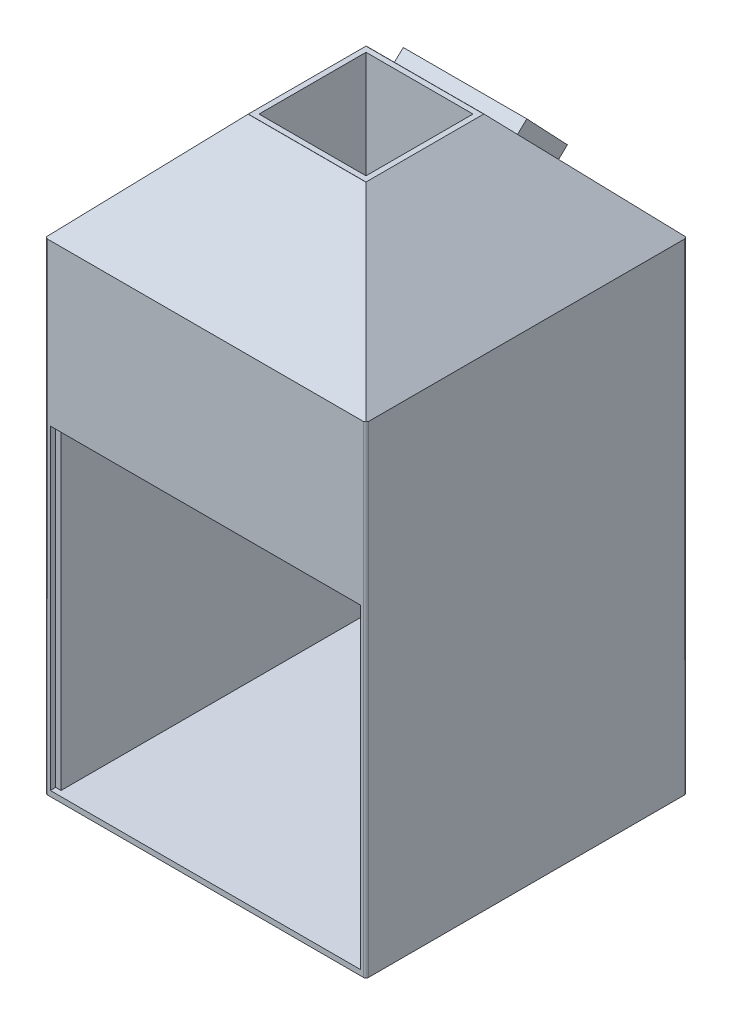
from build123d import *

# Parameters (mm, degrees)
SKETCH1_W            = 600
SKETCH1_H            = 600
BOSS_EXTRUDE1_DEPTH  = 10
SKETCH2_W            = 600
SKETCH2_H            = 600
SKETCH2_W_2          = 560
SKETCH2_H_2          = 560
BOSS_AREA_C_DEPTH    = 590
SKETCH4_W            = 560
SKETCH4_H            = 20
CUT_AREA_C_DEPTH     = 590
SKETCH5_W            = 600
SKETCH5_H            = 600
SKETCH5_W_2          = 560
SKETCH5_H_2          = 560
AREA_B_DEPTH         = 300
SKETCH7_W            = 10
SKETCH7_H            = 590
CUT_EXTRUDE3_DEPTH   = 10
SKETCH8_W            = 220
SKETCH8_H            = 220
SKETCH8_W_2          = 200
SKETCH8_H_2          = 200
BOSS_EXTRUDE7_DEPTH  = 210
BOSS_EXTRUDE8_DEPTH  = 600
CUT_EXTRUDE4_DEPTH   = 600
BOSS_EXTRUDE9_DEPTH  = 600
CUT_EXTRUDE5_DEPTH   = 600
SKETCH16_W           = 231
SKETCH16_H           = 110
SKETCH16_W_2         = 210
SKETCH16_H_2         = 100
BOSS_EXTRUDE13_DEPTH = 25
SKETCH18_R           = 10
CUT_EXTRUDE6_DEPTH   = 35
FILLET1_R            = 5


with BuildPart() as part:
    # Sketch1 → Boss-Extrude1 (new body)
    with BuildSketch(Plane(origin=(0, 0, 0), x_dir=(1, 0, 0), z_dir=(0, 1, 0))):
        Rectangle(SKETCH1_W, SKETCH1_H)
    extrude(amount=BOSS_EXTRUDE1_DEPTH)

    # Sketch2 → Boss-Area C (add)
    with BuildSketch(Plane(origin=(0, 10, 0), x_dir=(1, 0, 0), z_dir=(0, 1, 0))):
        Rectangle(SKETCH2_W, SKETCH2_H)
        Rectangle(SKETCH2_W_2, SKETCH2_H_2, mode=Mode.SUBTRACT)
    extrude(amount=BOSS_AREA_C_DEPTH)

    # Sketch4 → Cut-Area C (cut)
    with BuildSketch(Plane(origin=(0, 600, 0), x_dir=(1, 0, 0), z_dir=(0, 1, 0))):
        with Locations((0, -290)):
            Rectangle(SKETCH4_W, SKETCH4_H)
    extrude(amount=-CUT_AREA_C_DEPTH, mode=Mode.SUBTRACT)

    # Sketch5 → Area B (add)
    with BuildSketch(Plane(origin=(0, 600, 0), x_dir=(1, 0, 0), z_dir=(0, 1, 0))):
        Rectangle(SKETCH5_W, SKETCH5_H)
        Rectangle(SKETCH5_W_2, SKETCH5_H_2, mode=Mode.SUBTRACT)
    extrude(amount=AREA_B_DEPTH)

    # Sketch7 → Cut-Extrude3 (cut)
    with BuildSketch(Plane.XY.offset(300)):
        with Locations((285, 305)):
            Rectangle(SKETCH7_W, SKETCH7_H)
        with Locations((-285, 305)):
            Rectangle(SKETCH7_W, SKETCH7_H)
    extrude(amount=-CUT_EXTRUDE3_DEPTH, mode=Mode.SUBTRACT)



with BuildPart() as body_2:
    # Sketch8 → Boss-Extrude7 (new body)
    with BuildSketch(Plane(origin=(0, 1100, 0), x_dir=(1, 0, 0), z_dir=(0, 1, 0))):
        Rectangle(SKETCH8_W, SKETCH8_H)
        Rectangle(SKETCH8_W_2, SKETCH8_H_2, mode=Mode.SUBTRACT)
    extrude(amount=-BOSS_EXTRUDE7_DEPTH)


with BuildPart() as part_1:
    add(part.part)

    add(body_2.part)  # Boss-Extrude8 merges body 2
    # Sketch9 → Boss-Extrude8 (add)
    with BuildSketch(Plane(origin=(0, 0, -300), x_dir=(-1, 0, 0), z_dir=(0, 0, -1))):
        Polygon((300, 900), (110, 1100), (110, 1090), (290, 900), align=None)
    boss_extrude8 = extrude(amount=-BOSS_EXTRUDE8_DEPTH)

    # Mirror1: Boss-Extrude8 across plane
    add(boss_extrude8.mirror(Plane(origin=(0, 0, 0), x_dir=(0, 0, 1), z_dir=(1, 0, 0))))

    # Sketch10 → Cut-Extrude4 (cut)
    with BuildSketch(Plane.ZY.offset(300)):
        Polygon((-300, 900), (-300, 1100), (-110, 1100), align=None)
        Polygon((300, 1100), (110, 1100), (300, 900), align=None)
    extrude(amount=-CUT_EXTRUDE4_DEPTH, mode=Mode.SUBTRACT)

    # Sketch13 → Boss-Extrude9 (add)
    with BuildSketch(Plane(origin=(300, 0, 0), x_dir=(0, 0, -1), z_dir=(1, 0, 0))):
        Polygon((-300, 900), (-290, 900), (-110.315522005, 1090), (-110.315522005, 1100), align=None)
        Polygon((300, 900), (290, 900), (110.315522005, 1090), (110.315522005, 1100), align=None)
    extrude(amount=-BOSS_EXTRUDE9_DEPTH)

    # Sketch14 → Cut-Extrude5 (cut)
    with BuildSketch(Plane(origin=(0, 0, -300), x_dir=(-1, 0, 0), z_dir=(0, 0, -1))):
        Polygon((-110, 1100), (-300, 900), (-300, 1100), align=None)
        Polygon((300, 1100), (110, 1100), (300, 900), align=None)
    extrude(amount=-CUT_EXTRUDE5_DEPTH, mode=Mode.SUBTRACT)

    # Sketch16 → Boss-Extrude13 (add)
    with BuildSketch(Plane(origin=(0, 575.982283096, -607.305657461), x_dir=(-1, 0, 0), z_dir=(0, 0.6881475597150754, -0.7255707657135773))):
        with Locations((0, 584.806743705)):
            Rectangle(SKETCH16_W, SKETCH16_H)
        with Locations((0, 584.806743705)):
            Rectangle(SKETCH16_W_2, SKETCH16_H_2, mode=Mode.SUBTRACT)
    extrude(amount=BOSS_EXTRUDE13_DEPTH)

    # Sketch18 → Cut-Extrude6 (cut)
    with BuildSketch(Plane(origin=(0, 575.982283096, -607.305657461), x_dir=(-1, 0, 0), z_dir=(0, 0.6881475597150754, -0.7255707657135773))):
        with Locations(Location((-35, 584.806743705, 0), (0, 0, 90))):
            Circle(SKETCH18_R)
        with Locations(Location((35, 584.806743705, 0), (0, 0, 90))):
            Circle(SKETCH18_R)
    extrude(amount=-CUT_EXTRUDE6_DEPTH, mode=Mode.SUBTRACT)

    # Fillet1
    fillet1_edges = [part_1.edges().sort_by_distance(p)[0] for p in [
        (300, 450, 300),
        (-300, 450, 300),
        (-300, 450, -300),
        (300, 450, -300),
    ]]
    fillet(fillet1_edges, radius=FILLET1_R)


solid = part_1.part
